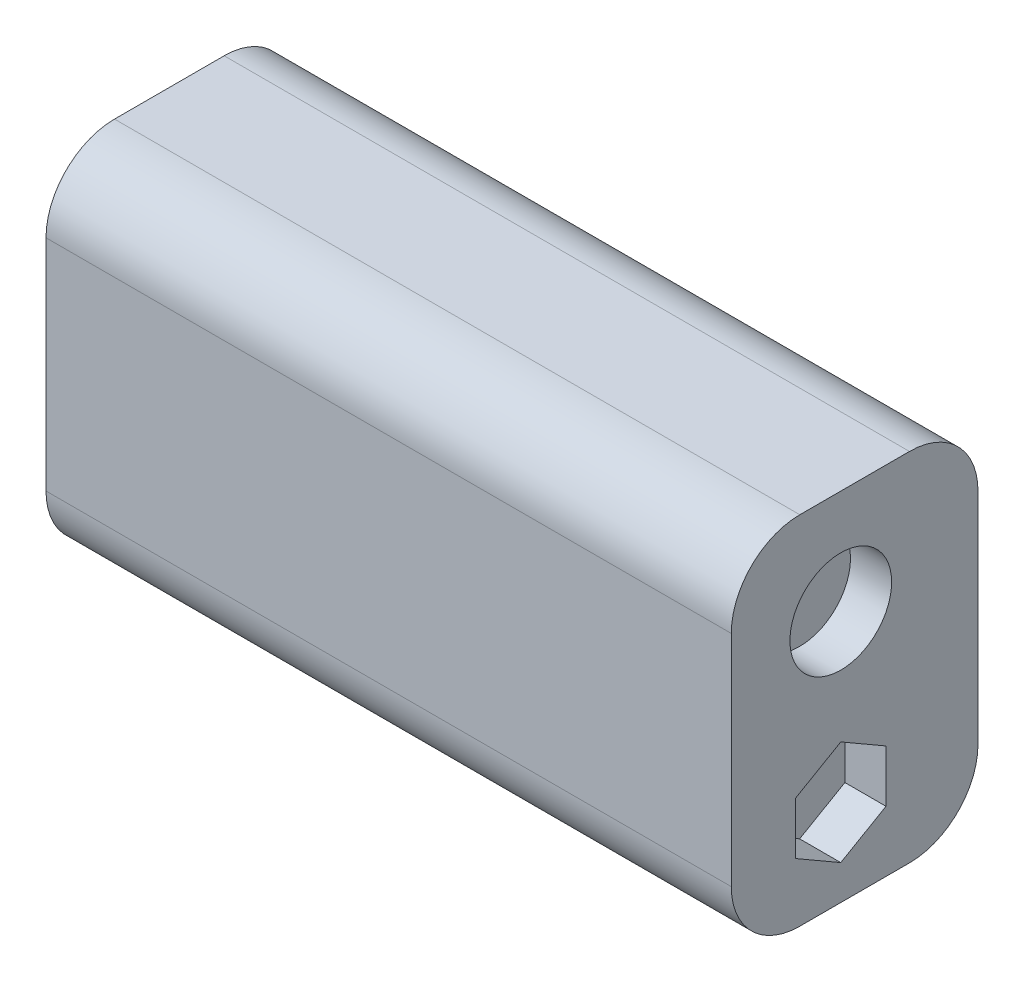
from build123d import *

# Parameters (mm, degrees)
SKETCH1_W           = 50
SKETCH1_H           = 26
BOSS_EXTRUDE1_DEPTH = 18
SKETCH2_R           = 3.709825946
CUT_EXTRUDE1_DEPTH  = 3
FILLET1_R           = 5
CUT_EXTRUDE4_START  = -5
SKETCH3_W           = 7
SKETCH3_H           = 6
CUT_EXTRUDE4_DEPTH  = 5


with BuildPart() as part:
    # Sketch1 → Boss-Extrude1 (new body)
    with BuildSketch(Plane.XY):
        Rectangle(SKETCH1_W, SKETCH1_H)
    extrude(amount=BOSS_EXTRUDE1_DEPTH)

    # Sketch2 → Cut-Extrude1 (cut)
    with BuildSketch(Plane(origin=(25, 0, 0), x_dir=(0, 0, -1), z_dir=(1, 0, 0))):
        with Locations((-10.012439419, 5.395426064)):
            Circle(SKETCH2_R)
        Polygon((-10.012439419, -2.84865676), (-13.313646894, -4.754609784), (-13.313646894, -8.566515832), (-10.012439419, -10.472468856), (-6.711231945, -8.566515832), (-6.711231945, -4.754609784), align=None)
    extrude(amount=-CUT_EXTRUDE1_DEPTH, mode=Mode.SUBTRACT)

    # Fillet1
    fillet1_edges = [part.edges().sort_by_distance(p)[0] for p in [
        (0, -13, 18),
        (0, -13, 0),
        (0, 13, 0),
        (0, 13, 18),
    ]]
    fillet(fillet1_edges, radius=FILLET1_R)

    # Sketch3 → Cut-Extrude4 (cut)
    with BuildSketch(Plane.ZY.offset(25).offset(CUT_EXTRUDE4_START)):
        with BuildLine():
            Line((7, -4), (0, -4))
            Line((0, -4), (0, -8))
            ThreePointArc((0, -8), (0.105468435, -9.021548218), (0.417424305, -10))
            Line((0.417424305, -10), (7, -10))
            Line((7, -10), (7, -4))
        make_face()
        with Locations((3.5, -1)):
            Rectangle(SKETCH3_W, SKETCH3_H)
    extrude(amount=CUT_EXTRUDE4_DEPTH, mode=Mode.SUBTRACT)


solid = part.part
